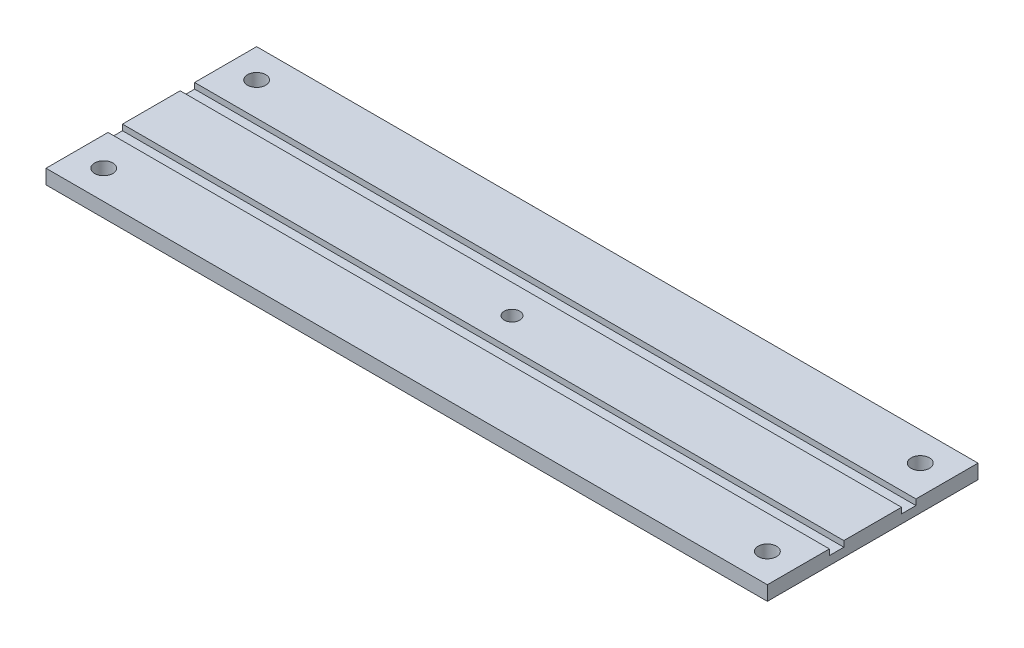
from build123d import *

# Parameters (mm, degrees)
SKETCH1_W                   = 250
SKETCH1_H                   = 73
RIGHT_WALL_DEPTH            = 5
F_1_4_0_2500_DOWEL_HOLE1_D  = 6.35
TAP_DRILL_FOR_1_4_28_TAP2_D = 5.4102
SKETCH24_W                  = 250
SKETCH24_H                  = 5
CUT_EXTRUDE1_DEPTH          = 2


with BuildPart() as part:
    # Sketch1 → right wall (new body)
    with BuildSketch(Plane(origin=(0, 0, 0), x_dir=(1, 0, 0), z_dir=(0, 1, 0))):
        with Locations((125, 36.5)):
            Rectangle(SKETCH1_W, SKETCH1_H)
    extrude(amount=RIGHT_WALL_DEPTH)

    # 1/4 (0.2500) Dowel Hole1 (through all)
    with Locations(Plane(origin=(0, 0, 0), x_dir=(-1, 0, 0), z_dir=(0, -1, 0))):
        with Locations((-10, 10), (-10, 63), (-240, 63), (-240, 10)):
            Hole(F_1_4_0_2500_DOWEL_HOLE1_D / 2)

    # Tap Drill for 1/4-28 Tap2 (through all)
    with Locations(Plane(origin=(0, 0, 0), x_dir=(-1, 0, 0), z_dir=(0, -1, 0))):
        with Locations((-125, 36.5)):
            Hole(TAP_DRILL_FOR_1_4_28_TAP2_D / 2)

    # Sketch24 → Cut-Extrude1 (cut)
    with BuildSketch(Plane(origin=(0, 5, 0), x_dir=(1, 0, 0), z_dir=(0, 1, 0))):
        with Locations((125, 49)):
            Rectangle(SKETCH24_W, SKETCH24_H)
        with Locations((125, 24)):
            Rectangle(SKETCH24_W, SKETCH24_H)
    extrude(amount=-CUT_EXTRUDE1_DEPTH, mode=Mode.SUBTRACT)


solid = part.part
